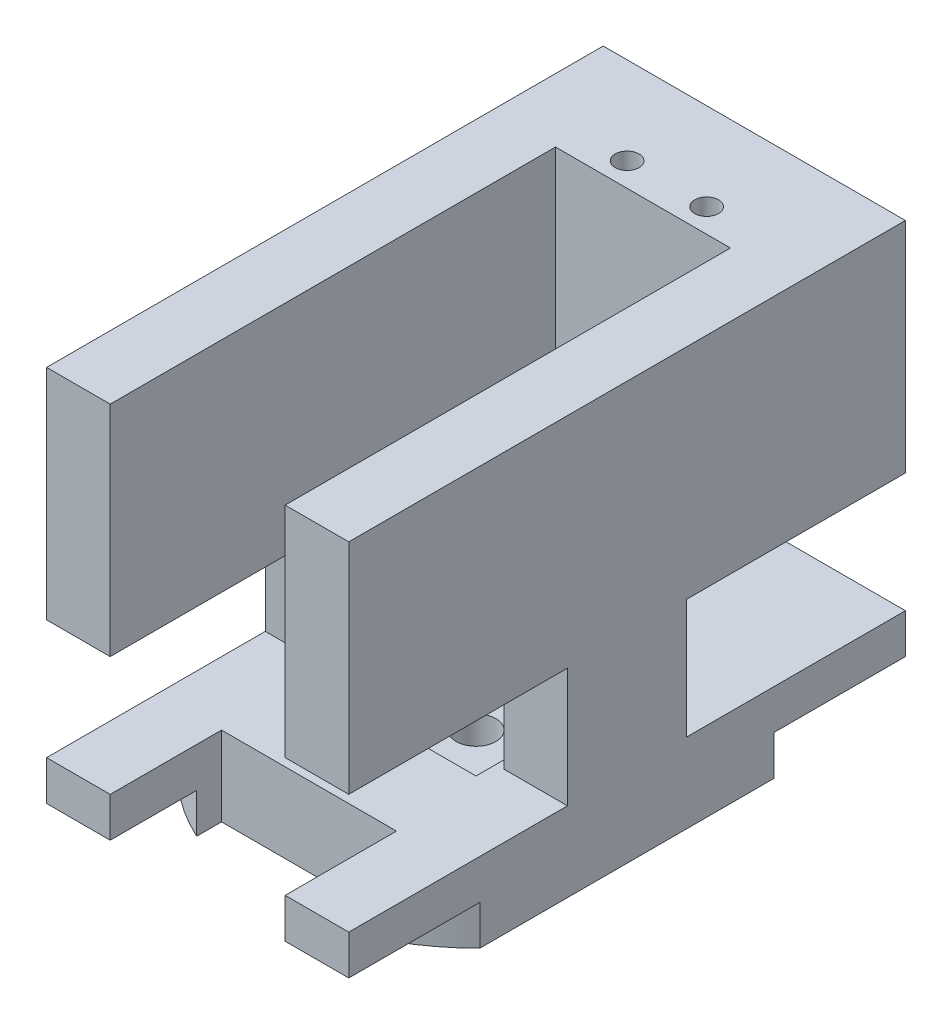
from build123d import *

# Parameters (mm, degrees)
SKETCH1_W           = 90
SKETCH1_H           = 70
BOSS_EXTRUDE1_DEPTH = 12.5
SKETCH3_W           = 90
SKETCH3_H           = 15
BOSS_EXTRUDE2_DEPTH = 15
SKETCH4_R           = 1.25
SKETCH4_W           = 22
SKETCH4_H           = 42
CUT_EXTRUDE1_DEPTH  = 64.294944506
SKETCH7_W           = 90
SKETCH7_H           = 70
SKETCH7_W_2         = 20
SKETCH7_H_2         = 20
BOSS_EXTRUDE3_DEPTH = 5
SKETCH8_R           = 26.514354508
SKETCH8_R_2         = 2.5
BOSS_EXTRUDE4_DEPTH = 5
SKETCH12_W          = 22
SKETCH12_H          = 14
CUT_EXTRUDE3_DEPTH  = 69.23672032
SKETCH16_W          = 26
SKETCH16_H          = 70
CUT_EXTRUDE5_DEPTH  = 69.23672032
BOSS_EXTRUDE5_START = 15
SKETCH17_R          = 1.25
BOSS_EXTRUDE5_DEPTH = 15
SKETCH18_R          = 1.5
CUT_EXTRUDE6_DEPTH  = 30


with BuildPart() as part:
    # Sketch1 → Boss-Extrude1 (new body)
    with BuildSketch(Plane(origin=(0, 0, 0), x_dir=(1, 0, 0), z_dir=(0, 1, 0))):
        Rectangle(SKETCH1_W, SKETCH1_H)
    extrude(amount=BOSS_EXTRUDE1_DEPTH)

    # Sketch3 → Boss-Extrude2 (add)
    with BuildSketch(Plane.XZ):
        Rectangle(SKETCH3_W, SKETCH3_H)
    extrude(amount=BOSS_EXTRUDE2_DEPTH)

    # Sketch4 → Cut-Extrude1 (cut, through all)
    with BuildSketch(Plane(origin=(0, 12.5, 0), x_dir=(1, 0, 0), z_dir=(0, 1, 0))):
        with Locations(Location((-5, 24, 0), (0, 0, 270))):
            Circle(SKETCH4_R)
        with Locations(Location((5, 24, 0), (0, 0, 270))):
            Circle(SKETCH4_R)
        with Locations(Location((5, -24, 0), (0, 0, 270))):
            Circle(SKETCH4_R)
        with Locations(Location((-5, -24, 0), (0, 0, 270))):
            Circle(SKETCH4_R)
        Rectangle(SKETCH4_W, SKETCH4_H)
    extrude(amount=-CUT_EXTRUDE1_DEPTH, mode=Mode.SUBTRACT)

    # Sketch7 → Boss-Extrude3 (add)
    with BuildSketch(Plane.XZ.offset(15)):
        Rectangle(SKETCH7_W, SKETCH7_H)
        Rectangle(SKETCH7_W_2, SKETCH7_H_2, mode=Mode.SUBTRACT)
    extrude(amount=BOSS_EXTRUDE3_DEPTH)

    # Sketch8 → Boss-Extrude4 (add)
    with BuildSketch(Plane.XZ.offset(20)):
        with Locations(Location((0, 0, 0), (0, 0, 270))):
            Circle(SKETCH8_R)
        with Locations(Location((0, 0, 0), (0, 0, 270))):
            Circle(SKETCH8_R_2, mode=Mode.SUBTRACT)
    extrude(amount=BOSS_EXTRUDE4_DEPTH)

    # Sketch12 → Cut-Extrude3 (cut, through all)
    with BuildSketch(Plane(origin=(0, 12.5, 0), x_dir=(1, 0, 0), z_dir=(0, 1, 0))):
        with Locations((0, -28)):
            Rectangle(SKETCH12_W, SKETCH12_H)
    extrude(amount=-CUT_EXTRUDE3_DEPTH, mode=Mode.SUBTRACT)

    # Sketch16 → Cut-Extrude5 (cut, through all)
    with BuildSketch(Plane(origin=(0, 12.5, 0), x_dir=(1, 0, 0), z_dir=(0, 1, 0))):
        with Locations((-32, 0)):
            Rectangle(SKETCH16_W, SKETCH16_H)
        with Locations((32, 0)):
            Rectangle(SKETCH16_W, SKETCH16_H)
    extrude(amount=-CUT_EXTRUDE5_DEPTH, mode=Mode.SUBTRACT)

    # Sketch17 → Boss-Extrude5 (add)
    with BuildSketch(Plane(origin=(0, 12.5, 0), x_dir=(1, 0, 0), z_dir=(0, 1, 0)).offset(BOSS_EXTRUDE5_START)):
        Polygon((19, 35), (-19, 35), (-19, -35), (-11, -35), (-11, 21), (11, 21), (11, -35), (19, -35), align=None)
        with Locations(Location((5, 24, 0), (0, 0, 270))):
            Circle(SKETCH17_R, mode=Mode.SUBTRACT)
        with Locations(Location((-5, 24, 0), (0, 0, 270))):
            Circle(SKETCH17_R, mode=Mode.SUBTRACT)
    extrude(amount=-BOSS_EXTRUDE5_DEPTH)

    # Sketch18 → Cut-Extrude6 (cut)
    with BuildSketch(Plane(origin=(0, 27.5, 0), x_dir=(1, 0, 0), z_dir=(0, 1, 0))):
        with Locations(Location((-5, 24, 0), (0, 0, 270))):
            Circle(SKETCH18_R)
        with Locations(Location((5, 24, 0), (0, 0, 270))):
            Circle(SKETCH18_R)
    extrude(amount=-CUT_EXTRUDE6_DEPTH, mode=Mode.SUBTRACT)


solid = part.part
